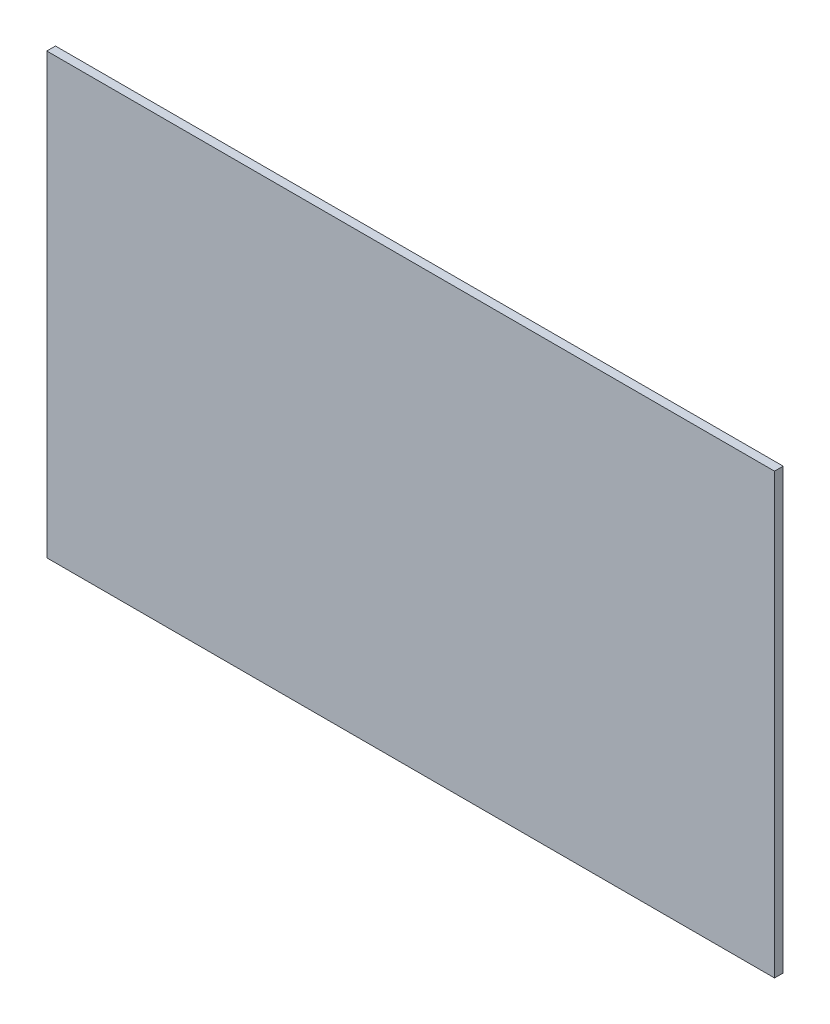
from build123d import *

# Parameters (mm, degrees)
SKETCH1_W           = 1600.2
SKETCH1_H           = 965.2
BOSS_EXTRUDE1_DEPTH = 19.05


with BuildPart() as part:
    # Sketch1 → Boss-Extrude1 (new body)
    with BuildSketch(Plane.XY):
        with Locations((800.1, -482.6)):
            Rectangle(SKETCH1_W, SKETCH1_H)
    extrude(amount=BOSS_EXTRUDE1_DEPTH)


solid = part.part
